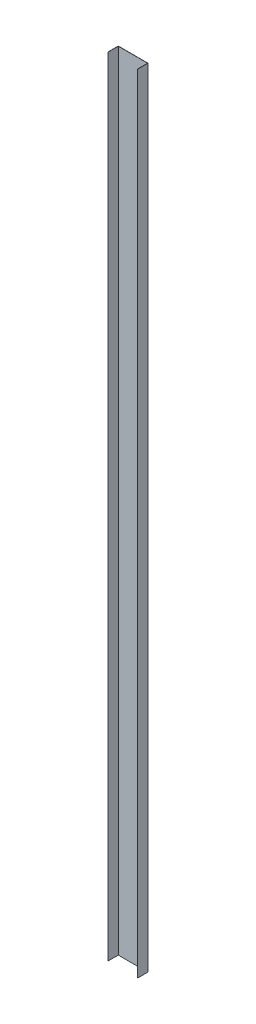
from build123d import *

# Parameters (mm, degrees)
BOSS_EXTRUDE1_DEPTH = 2438.4


with BuildPart() as part:
    # Sketch1 → Boss-Extrude1 (new body)
    with BuildSketch(Plane(origin=(0, 0, 0), x_dir=(1, 0, 0), z_dir=(0, 1, 0))):
        Polygon((0, 0), (0, 31.219), (91.013, 31.219), (91.013, 0), (91.544, 0), (91.544, 31.75), (-0.531, 31.75), (-0.531, 0), align=None)
    extrude(amount=BOSS_EXTRUDE1_DEPTH)


solid = part.part
